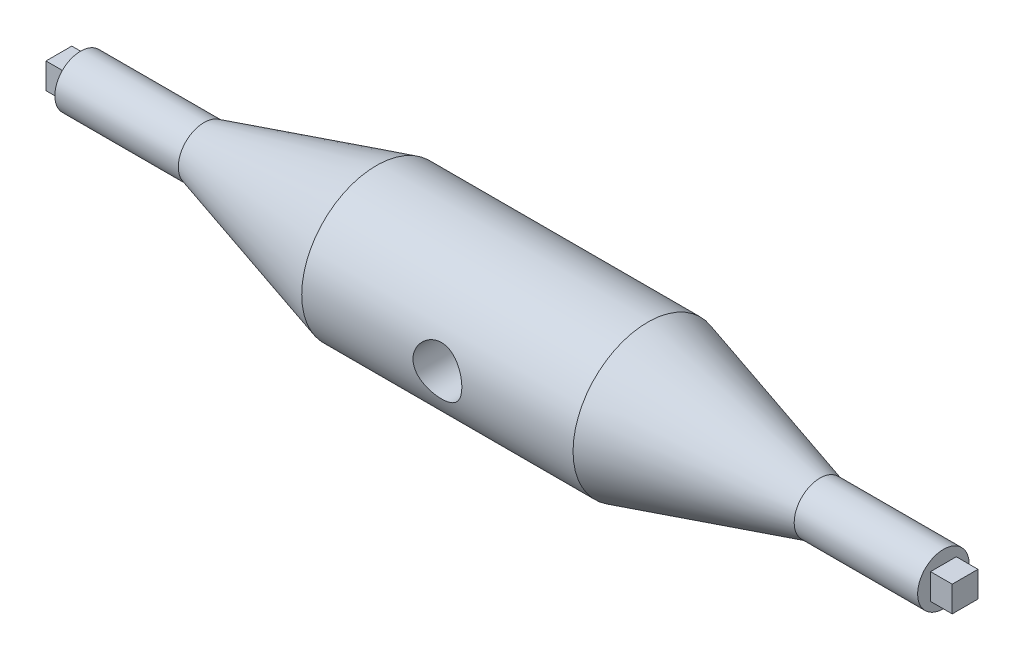
from build123d import *

# Parameters (mm, degrees)
ESQUISSE5_W                  = 4.75
ESQUISSE5_H                  = 4.75
BOSS_EXTRU_3_DEPTH           = 4
BOSS_EXTRU_4_DEPTH           = 4
ENL_V_MAT_EXTRU_1_DEPTH      = 40
ENL_V_MAT_EXTRU_1_DEPTH_BACK = 30
ESQUISSE7_R                  = 4.5


with BuildPart() as part:
    # Esquisse1 → Révolution1 (revolve)
    with BuildSketch(Plane(origin=(0, 0, 0), x_dir=(1, 0, 0), z_dir=(0, 1, 0))):
        Polygon((0, 0), (0, 4.75), (159, 4.75), (159, 0), (136.25, 0), (104.5, -9), (54.5, -9), (22.75, 0), align=None)
    revolve(axis=Axis((0, 0, -4.75), (1, 0, 0)))

    # Esquisse5 → Boss.-Extru.3 (add)
    with BuildSketch(Plane(origin=(159, 0, 0), x_dir=(0, 0, -1), z_dir=(1, 0, 0))):
        with Locations((4.75, 0)):
            Rectangle(ESQUISSE5_W, ESQUISSE5_H)
    extrude(amount=BOSS_EXTRU_3_DEPTH)

    # Esquisse6 → Boss.-Extru.4 (add)
    with BuildSketch(Plane.ZY):
        Polygon((-4.75, 2.375), (-7.125, 2.375), (-7.125, -2.375), (-2.375, -2.375), (-2.375, 2.375), align=None)
    extrude(amount=BOSS_EXTRU_4_DEPTH)

    # Esquisse7 → Enlèv. mat.-Extru.1 (cut, two sides: drawn at the far end of the back side and taken through both)
    with BuildSketch(Plane.XY.offset(-2.375).offset(-ENL_V_MAT_EXTRU_1_DEPTH_BACK)):
        with Locations(Location((79.5, 0, 0), (0, 0, 179.999999999))):
            Circle(ESQUISSE7_R)
    extrude(amount=ENL_V_MAT_EXTRU_1_DEPTH + ENL_V_MAT_EXTRU_1_DEPTH_BACK, mode=Mode.SUBTRACT)


solid = part.part
